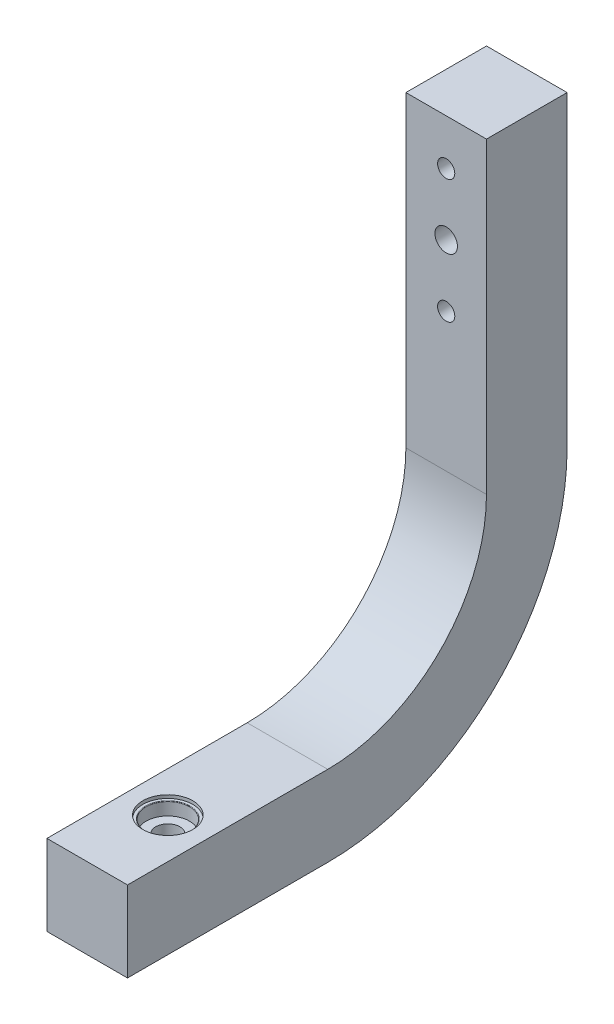
from build123d import *

# Parameters (mm, degrees)
BOSS_EXTRUDE1_DEPTH      = 7.5
BOSS_EXTRUDE1_DEPTH_BACK = 7.5
SKETCH3_R                = 2.25
CUT_EXTRUDE1_DEPTH       = 120.512655858
CUT_EXTRUDE2_DEPTH       = 106.882442604
CUT_EXTRUDE2_DEPTH_BACK  = 106.882442604
SKETCH4_R                = 2.1
SKETCH4_R_2              = 1.6


with BuildPart() as part:
    # Sketch1 → Boss-Extrude1 (new, two sides: drawn at the far end of the back side and taken through both)
    with BuildSketch(Plane(origin=(0, 0, 0), x_dir=(0, 0, -1), z_dir=(1, 0, 0)).offset(-BOSS_EXTRUDE1_DEPTH_BACK)):
        with BuildLine():
            Line((-15, 20), (0, 20))
            Line((0, 20), (0, -37.26819382))
            ThreePointArc((0, -37.26819382), (-13.04440593, -68.76017553), (-44.53638764, -81.80458146))
            Line((-44.53638764, -81.80458146), (-66.80458146, -81.80458146))
            Line((-66.80458146, -81.80458146), (-81.80458146, -81.80458146))
            Line((-81.80458146, -81.80458146), (-81.80458146, -66.80458146))
            Line((-81.80458146, -66.80458146), (-66.80458146, -66.80458146))
            Line((-66.80458146, -66.80458146), (-44.53638764, -66.80458146))
            ThreePointArc((-44.53638764, -66.80458146), (-23.651007648, -58.153573812), (-15, -37.26819382))
            Line((-15, -37.26819382), (-15, 20))
        make_face()
    extrude(amount=BOSS_EXTRUDE1_DEPTH + BOSS_EXTRUDE1_DEPTH_BACK)

    # Sketch3 → Cut-Extrude1 (cut, through all)
    with BuildSketch(Plane(origin=(0, -66.80458146, 0), x_dir=(1, 0, 0), z_dir=(0, 1, 0))):
        with Locations((0, -66.80458146)):
            Circle(SKETCH3_R)
    extrude(amount=-CUT_EXTRUDE1_DEPTH, mode=Mode.SUBTRACT)

    # Sketch4 → Cut-Extrude2 (cut, two sides: drawn at the far end of the back side and taken through both)
    with BuildSketch(Plane.XY.offset(15).offset(-CUT_EXTRUDE2_DEPTH_BACK)):
        Circle(SKETCH4_R)
        with Locations((0, 11.5)):
            Circle(SKETCH4_R_2)
        with Locations((0, -11.5)):
            Circle(SKETCH4_R_2)
    extrude(amount=CUT_EXTRUDE2_DEPTH + CUT_EXTRUDE2_DEPTH_BACK, mode=Mode.SUBTRACT)

    # Sketch5 → Cut-Revolve1 (revolve, cut)
    with BuildSketch(Plane(origin=(0, 0, 0), x_dir=(0, 0, -1), z_dir=(1, 0, 0))):
        with BuildLine():
            Line((-62.75458146, -78.80458146), (-62.75458146, -81.10458146))
            ThreePointArc((-62.75458146, -81.10458146), (-62.725292138, -81.175292138), (-62.65458146, -81.20458146))
            Line((-62.65458146, -81.20458146), (-62.15458146, -81.20458146))
            Line((-62.15458146, -81.20458146), (-62.15458146, -81.80458146))
            Line((-62.15458146, -81.80458146), (-66.80458146, -81.80458146))
            Line((-66.80458146, -81.80458146), (-66.80458146, -78.80458146))
            Line((-66.80458146, -78.80458146), (-62.75458146, -78.80458146))
        make_face()
        with BuildLine():
            Line((-66.80458146, -69.80458146), (-62.75458146, -69.80458146))
            Line((-62.75458146, -69.80458146), (-62.75458146, -67.50458146))
            ThreePointArc((-62.75458146, -67.50458146), (-62.725292138, -67.433870782), (-62.65458146, -67.40458146))
            Line((-62.65458146, -67.40458146), (-62.15458146, -67.40458146))
            Line((-62.15458146, -67.40458146), (-62.15458146, -66.80458146))
            Line((-62.15458146, -66.80458146), (-66.80458146, -66.80458146))
            Line((-66.80458146, -66.80458146), (-66.80458146, -69.80458146))
        make_face()
    revolve(axis=Axis((0, -52.168735771, 66.80458146), (0, 1, 0)), mode=Mode.SUBTRACT)


solid = part.part
